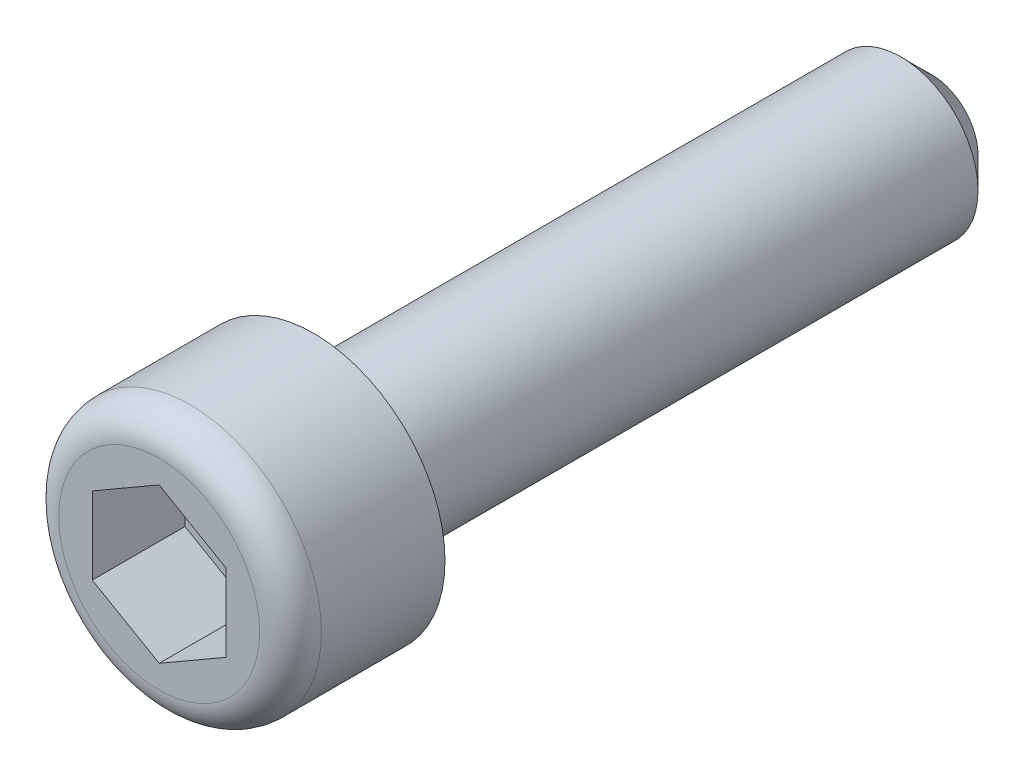
from build123d import *

# Parameters (mm, degrees)
FOOTPRINT_DEPTH = 3
CHAMFER1_SIZE   = 1
FILLET1_R       = 1


with BuildPart() as part:
    # Sketch1 → Body (revolve)
    with BuildSketch(Plane(origin=(0, 0, 0), x_dir=(0, 0, -1), z_dir=(1, 0, 0)), mode=Mode.PRIVATE) as body_sk:
        Polygon((0, 0), (0, 4.25), (5, 4.25), (5, 2.5), (25, 2.5), (25, 0), align=None)
    revolve(body_sk.sketch.rotate(Axis((0, 0, 156.291575099), (0, 0, -1)), 90), axis=Axis((0, 0, 156.291575099), (0, 0, -1)))

    # Sketch2 → Footprint (cut)
    with BuildSketch(Plane.XY):
        Polygon((0, 2.5), (-2.165063509, 1.25), (-2.165063509, -1.25), (0, -2.5), (2.165063509, -1.25), (2.165063509, 1.25), align=None)
    extrude(amount=-FOOTPRINT_DEPTH, mode=Mode.SUBTRACT)

    # Chamfer1
    chamfer1_edges = [part.edges().sort_by_distance(p)[0] for p in [
        (-2.5, 0, -25),
    ]]
    chamfer(chamfer1_edges, length=CHAMFER1_SIZE)

    # Fillet1
    fillet1_edges = [part.edges().sort_by_distance(p)[0] for p in [
        (-4.25, 0, 0),
    ]]
    fillet(fillet1_edges, radius=FILLET1_R)


solid = part.part
